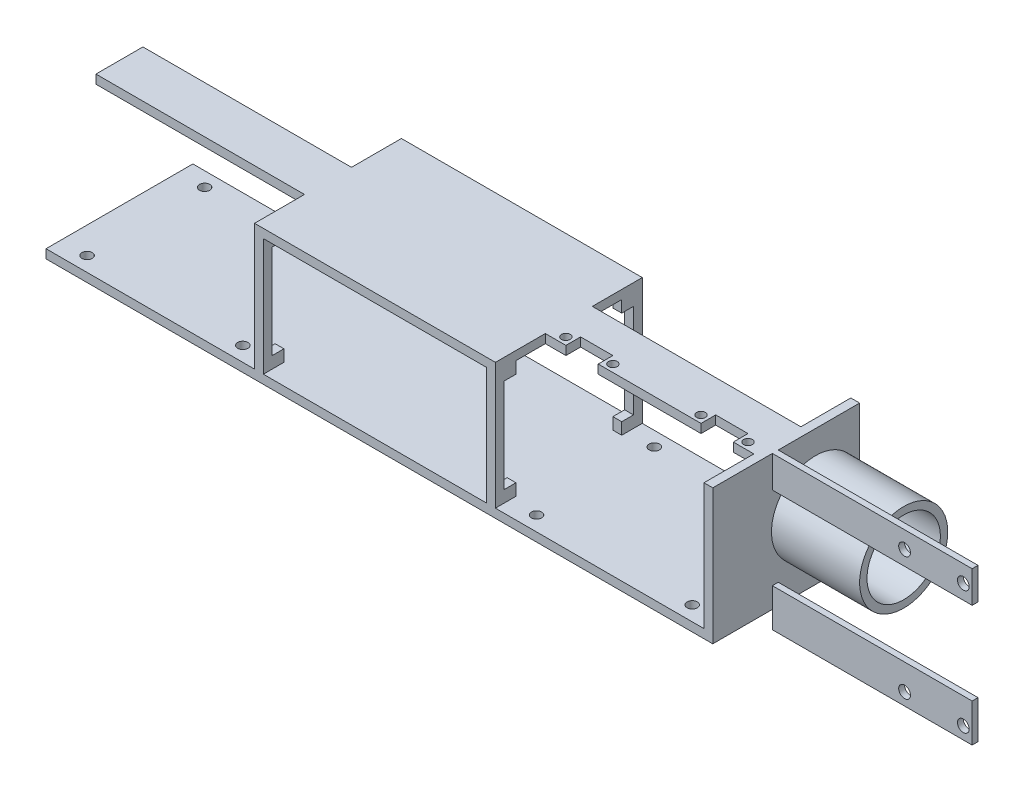
from build123d import *

# Parameters (mm, degrees)
SKETCH1_W               = 82
SKETCH1_H               = 46
BOSS_EXTRUDE1_DEPTH     = 25
CUT_EXTRUDE1_REACH      = 70.629
SKETCH2_W               = 76
SKETCH2_H               = 40
CUT_EXTRUDE2_DEPTH      = 89.758098222
CUT_EXTRUDE2_DEPTH_BACK = 89.758098222
SKETCH4_W               = 50
SKETCH4_H               = 3
BOSS_EXTRUDE2_DEPTH     = 71
CUT_EXTRUDE3_REACH      = 124.548
SKETCH5_R               = 1.75
SKETCH7_W               = 16
SKETCH7_H               = 3
BOSS_EXTRUDE4_DEPTH     = 71
SKETCH8_W               = 50
SKETCH8_H               = 46
BOSS_EXTRUDE5_DEPTH     = 3
CUT_EXTRUDE4_DEPTH      = 127.356638132
CUT_EXTRUDE4_DEPTH_BACK = 3
CUT_EXTRUDE5_REACH      = 128.357
SKETCH10_W              = 11
SKETCH10_H              = 5
CUT_EXTRUDE6_REACH      = 128.357
SKETCH11_R              = 1.5
SKETCH12_R              = 15
BOSS_EXTRUDE6_DEPTH     = 30
SKETCH13_R              = 12.5
CUT_EXTRUDE7_DEPTH      = 190.076704012
SKETCH14_W              = 2
SKETCH14_H              = 10.8
SKETCH14_H_2            = 13
BOSS_EXTRUDE7_DEPTH     = 68
CUT_EXTRUDE8_REACH      = 189.343
SKETCH15_R              = 2


with BuildPart() as part:
    # Sketch1 → Boss-Extrude1 (new, symmetric)
    with BuildSketch(Plane.XY):
        Rectangle(SKETCH1_W, SKETCH1_H)
    extrude(amount=BOSS_EXTRUDE1_DEPTH, both=True)

    # Sketch2 → Cut-Extrude1 (cut, up to next)
    with BuildSketch(Plane.XY.offset(25), mode=Mode.PRIVATE) as cut_extrude1_sk1:
        Rectangle(SKETCH2_W, SKETCH2_H)
    cut_extrude1_tool1 = extrude(cut_extrude1_sk1.sketch, amount=-CUT_EXTRUDE1_REACH, mode=Mode.PRIVATE) & part.part
    add(cut_extrude1_tool1.solids().sort_by_distance((0, 0, 25))[0], mode=Mode.SUBTRACT)

    # Sketch3 → Cut-Extrude2 (cut, two sides: drawn at the far end of the back side and taken through both)
    with BuildSketch(Plane.ZY.offset(41).offset(-CUT_EXTRUDE2_DEPTH_BACK)):
        Polygon((-18, 16), (-18, 20), (18, 20), (18, 16), (22, 16), (22, -16), (18, -16), (18, -20), (-18, -20), (-18, -16), (-22, -16), (-22, 16), align=None)
    extrude(amount=CUT_EXTRUDE2_DEPTH + CUT_EXTRUDE2_DEPTH_BACK, mode=Mode.SUBTRACT)

    # Sketch4 → Boss-Extrude2 (add)
    with BuildSketch(Plane(origin=(41, 0, 0), x_dir=(0, 0, -1), z_dir=(1, 0, 0))):
        with Locations((0, -21.5)):
            Rectangle(SKETCH4_W, SKETCH4_H)
    boss_extrude2 = extrude(amount=BOSS_EXTRUDE2_DEPTH)

    # Sketch5 → Cut-Extrude3 (cut, up to next)
    with BuildSketch(Plane(origin=(0, -20, 0), x_dir=(1, 0, 0), z_dir=(0, 1, 0)), mode=Mode.PRIVATE) as cut_extrude3_sk1:
        with Locations(Location((103.1, 20.1, 0), (0, 0, 270))):
            Circle(SKETCH5_R)
    cut_extrude3_tool1 = extrude(cut_extrude3_sk1.sketch, amount=-CUT_EXTRUDE3_REACH, mode=Mode.PRIVATE) & part.part
    # Sketch5 → Cut-Extrude3 (cut, up to next)
    with BuildSketch(Plane(origin=(0, -20, 0), x_dir=(1, 0, 0), z_dir=(0, 1, 0)), mode=Mode.PRIVATE) as cut_extrude3_sk2:
        with Locations(Location((103, -20, 0), (0, 0, 270))):
            Circle(SKETCH5_R)
    cut_extrude3_tool2 = extrude(cut_extrude3_sk2.sketch, amount=-CUT_EXTRUDE3_REACH, mode=Mode.PRIVATE) & part.part
    # Sketch5 → Cut-Extrude3 (cut, up to next)
    with BuildSketch(Plane(origin=(0, -20, 0), x_dir=(1, 0, 0), z_dir=(0, 1, 0)), mode=Mode.PRIVATE) as cut_extrude3_sk3:
        with Locations(Location((50, 20.1, 0), (0, 0, 270))):
            Circle(SKETCH5_R)
    cut_extrude3_tool3 = extrude(cut_extrude3_sk3.sketch, amount=-CUT_EXTRUDE3_REACH, mode=Mode.PRIVATE) & part.part
    # Sketch5 → Cut-Extrude3 (cut, up to next)
    with BuildSketch(Plane(origin=(0, -20, 0), x_dir=(1, 0, 0), z_dir=(0, 1, 0)), mode=Mode.PRIVATE) as cut_extrude3_sk4:
        with Locations(Location((50, -20, 0), (0, 0, 270))):
            Circle(SKETCH5_R)
    cut_extrude3_tool4 = extrude(cut_extrude3_sk4.sketch, amount=-CUT_EXTRUDE3_REACH, mode=Mode.PRIVATE) & part.part
    cut_extrude3_1 = cut_extrude3_tool1.solids().sort_by_distance((103.1, -20, -20.1))[0]
    add(cut_extrude3_1, mode=Mode.SUBTRACT)
    cut_extrude3_2 = cut_extrude3_tool2.solids().sort_by_distance((103, -20, 20))[0]
    add(cut_extrude3_2, mode=Mode.SUBTRACT)
    cut_extrude3_3 = cut_extrude3_tool3.solids().sort_by_distance((50, -20, -20.1))[0]
    add(cut_extrude3_3, mode=Mode.SUBTRACT)
    cut_extrude3_4 = cut_extrude3_tool4.solids().sort_by_distance((50, -20, 20))[0]
    add(cut_extrude3_4, mode=Mode.SUBTRACT)
    cut_extrude3 = cut_extrude3_1 + cut_extrude3_2 + cut_extrude3_3 + cut_extrude3_4  # Cut-Extrude3 as one shape, for the pattern or mirror that repeats it

    # Sketch7 → Boss-Extrude4 (add)
    with BuildSketch(Plane(origin=(41, 0, 0), x_dir=(0, 0, -1), z_dir=(1, 0, 0))):
        with Locations((0, 21.5)):
            Rectangle(SKETCH7_W, SKETCH7_H)
    boss_extrude4 = extrude(amount=BOSS_EXTRUDE4_DEPTH)

    # Sketch8 → Boss-Extrude5 (add)
    with BuildSketch(Plane(origin=(112, 0, 0), x_dir=(0, 0, -1), z_dir=(1, 0, 0))):
        Rectangle(SKETCH8_W, SKETCH8_H)
    extrude(amount=BOSS_EXTRUDE5_DEPTH)

    # Sketch9 → Cut-Extrude4 (cut, two sides: drawn at the far end of the back side and taken through both)
    with BuildSketch(Plane(origin=(0, 23, 0), x_dir=(1, 0, 0), z_dir=(0, 1, 0)).offset(-CUT_EXTRUDE4_DEPTH_BACK)):
        Polygon((105, -317.365996733), (105, -8), (105, -3), (94, -3), (94, -8), (94, -317.365996733), (94, -936.097990199), (105, -936.097990199), align=None)
    extrude(amount=CUT_EXTRUDE4_DEPTH + CUT_EXTRUDE4_DEPTH_BACK, mode=Mode.SUBTRACT)

    # Sketch10 → Cut-Extrude5 (cut, up to next)
    with BuildSketch(Plane(origin=(0, 23, 0), x_dir=(1, 0, 0), z_dir=(0, 1, 0)), mode=Mode.PRIVATE) as cut_extrude5_sk1:
        with Locations((53.5, -5.5)):
            Rectangle(SKETCH10_W, SKETCH10_H)
    cut_extrude5_tool1 = extrude(cut_extrude5_sk1.sketch, amount=-CUT_EXTRUDE5_REACH, mode=Mode.PRIVATE) & part.part
    add(cut_extrude5_tool1.solids().sort_by_distance((53.5, 23, 5.5))[0], mode=Mode.SUBTRACT)

    # Sketch11 → Cut-Extrude6 (cut, up to next)
    with BuildSketch(Plane(origin=(0, 23, 0), x_dir=(1, 0, 0), z_dir=(0, 1, 0)), mode=Mode.PRIVATE) as cut_extrude6_sk1:
        with Locations(Location((45.5, -5.5, 0), (0, 0, 270))):
            Circle(SKETCH11_R)
    cut_extrude6_tool1 = extrude(cut_extrude6_sk1.sketch, amount=-CUT_EXTRUDE6_REACH, mode=Mode.PRIVATE) & part.part
    # Sketch11 → Cut-Extrude6 (cut, up to next)
    with BuildSketch(Plane(origin=(0, 23, 0), x_dir=(1, 0, 0), z_dir=(0, 1, 0)), mode=Mode.PRIVATE) as cut_extrude6_sk2:
        with Locations(Location((61.5, -5.5, 0), (0, 0, 270))):
            Circle(SKETCH11_R)
    cut_extrude6_tool2 = extrude(cut_extrude6_sk2.sketch, amount=-CUT_EXTRUDE6_REACH, mode=Mode.PRIVATE) & part.part
    # Sketch11 → Cut-Extrude6 (cut, up to next)
    with BuildSketch(Plane(origin=(0, 23, 0), x_dir=(1, 0, 0), z_dir=(0, 1, 0)), mode=Mode.PRIVATE) as cut_extrude6_sk3:
        with Locations(Location((91.5, -5.5, 0), (0, 0, 270))):
            Circle(SKETCH11_R)
    cut_extrude6_tool3 = extrude(cut_extrude6_sk3.sketch, amount=-CUT_EXTRUDE6_REACH, mode=Mode.PRIVATE) & part.part
    # Sketch11 → Cut-Extrude6 (cut, up to next)
    with BuildSketch(Plane(origin=(0, 23, 0), x_dir=(1, 0, 0), z_dir=(0, 1, 0)), mode=Mode.PRIVATE) as cut_extrude6_sk4:
        with Locations(Location((107.5, -5.5, 0), (0, 0, 270))):
            Circle(SKETCH11_R)
    cut_extrude6_tool4 = extrude(cut_extrude6_sk4.sketch, amount=-CUT_EXTRUDE6_REACH, mode=Mode.PRIVATE) & part.part
    add(cut_extrude6_tool1.solids().sort_by_distance((45.5, 23, 5.5))[0], mode=Mode.SUBTRACT)
    add(cut_extrude6_tool2.solids().sort_by_distance((61.5, 23, 5.5))[0], mode=Mode.SUBTRACT)
    add(cut_extrude6_tool3.solids().sort_by_distance((91.5, 23, 5.5))[0], mode=Mode.SUBTRACT)
    add(cut_extrude6_tool4.solids().sort_by_distance((107.5, 23, 5.5))[0], mode=Mode.SUBTRACT)

    # Sketch12 → Boss-Extrude6 (add)
    with BuildSketch(Plane(origin=(115, 0, 0), x_dir=(0, 0, -1), z_dir=(1, 0, 0))):
        with Locations((10, 0)):
            Circle(SKETCH12_R)
    extrude(amount=BOSS_EXTRUDE6_DEPTH)

    # Sketch13 → Cut-Extrude7 (cut, through all)
    with BuildSketch(Plane(origin=(145, 0, 0), x_dir=(0, 0, -1), z_dir=(1, 0, 0))):
        with Locations((10, 0)):
            Circle(SKETCH13_R)
    extrude(amount=-CUT_EXTRUDE7_DEPTH, mode=Mode.SUBTRACT)

    # Sketch14 → Boss-Extrude7 (add)
    with BuildSketch(Plane(origin=(115, 0, 0), x_dir=(0, 0, -1), z_dir=(1, 0, 0))):
        with Locations((-3.7, 17.6)):
            Rectangle(SKETCH14_W, SKETCH14_H)
        with Locations((-3.7, -22.5)):
            Rectangle(SKETCH14_W, SKETCH14_H_2)
    extrude(amount=BOSS_EXTRUDE7_DEPTH)

    # Sketch15 → Cut-Extrude8 (cut, up to next)
    with BuildSketch(Plane(origin=(0, 0, 2.7), x_dir=(-1, 0, 0), z_dir=(0, 0, -1)), mode=Mode.PRIVATE) as cut_extrude8_sk1:
        with Locations(Location((-180, -24.8, 0), (0, 0, 90))):
            Circle(SKETCH15_R)
    cut_extrude8_tool1 = extrude(cut_extrude8_sk1.sketch, amount=-CUT_EXTRUDE8_REACH, mode=Mode.PRIVATE) & part.part
    # Sketch15 → Cut-Extrude8 (cut, up to next)
    with BuildSketch(Plane(origin=(0, 0, 2.7), x_dir=(-1, 0, 0), z_dir=(0, 0, -1)), mode=Mode.PRIVATE) as cut_extrude8_sk2:
        with Locations(Location((-160, -24.8, 0), (0, 0, 90))):
            Circle(SKETCH15_R)
    cut_extrude8_tool2 = extrude(cut_extrude8_sk2.sketch, amount=-CUT_EXTRUDE8_REACH, mode=Mode.PRIVATE) & part.part
    # Sketch15 → Cut-Extrude8 (cut, up to next)
    with BuildSketch(Plane(origin=(0, 0, 2.7), x_dir=(-1, 0, 0), z_dir=(0, 0, -1)), mode=Mode.PRIVATE) as cut_extrude8_sk3:
        with Locations(Location((-160, 17.2, 0), (0, 0, 90))):
            Circle(SKETCH15_R)
    cut_extrude8_tool3 = extrude(cut_extrude8_sk3.sketch, amount=-CUT_EXTRUDE8_REACH, mode=Mode.PRIVATE) & part.part
    # Sketch15 → Cut-Extrude8 (cut, up to next)
    with BuildSketch(Plane(origin=(0, 0, 2.7), x_dir=(-1, 0, 0), z_dir=(0, 0, -1)), mode=Mode.PRIVATE) as cut_extrude8_sk4:
        with Locations(Location((-180, 17.2, 0), (0, 0, 90))):
            Circle(SKETCH15_R)
    cut_extrude8_tool4 = extrude(cut_extrude8_sk4.sketch, amount=-CUT_EXTRUDE8_REACH, mode=Mode.PRIVATE) & part.part
    add(cut_extrude8_tool1.solids().sort_by_distance((180, -24.8, 2.7))[0], mode=Mode.SUBTRACT)
    add(cut_extrude8_tool2.solids().sort_by_distance((160, -24.8, 2.7))[0], mode=Mode.SUBTRACT)
    add(cut_extrude8_tool3.solids().sort_by_distance((160, 17.2, 2.7))[0], mode=Mode.SUBTRACT)
    add(cut_extrude8_tool4.solids().sort_by_distance((180, 17.2, 2.7))[0], mode=Mode.SUBTRACT)

    # Mirror1: Boss-Extrude2, Cut-Extrude3, Boss-Extrude4 across plane
    add(boss_extrude2.mirror(Plane(origin=(0, 0, 0), x_dir=(0, 0, 1), z_dir=(1, 0, 0))))
    add(cut_extrude3.mirror(Plane(origin=(0, 0, 0), x_dir=(0, 0, 1), z_dir=(1, 0, 0))), mode=Mode.SUBTRACT)
    add(boss_extrude4.mirror(Plane(origin=(0, 0, 0), x_dir=(0, 0, 1), z_dir=(1, 0, 0))))


solid = part.part
